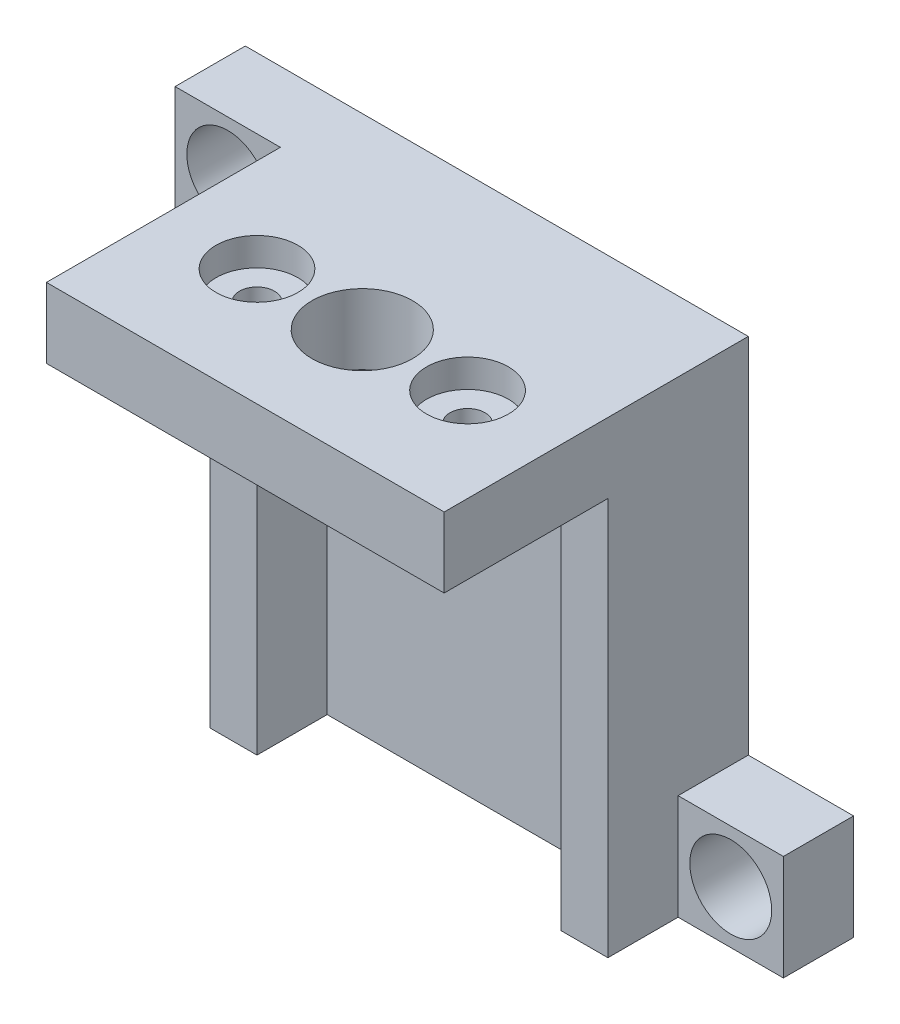
from build123d import *

# Parameters (mm, degrees)
BOSS_EXTRUDE1_DEPTH = 3
BOSS_EXTRUDE2_DEPTH = 3
SKETCH3_W           = 17
SKETCH3_H           = 13
SKETCH3_R           = 2.15
SKETCH3_R_2         = 0.75
BOSS_EXTRUDE3_DEPTH = 3
CUT_EXTRUDE2_REACH  = 32.336
SKETCH6_R           = 2.15
CUT_EXTRUDE3_REACH  = 33.02
SKETCH8_R           = 1.75
SKETCH4_R           = 1.75
CUT_EXTRUDE4_DEPTH  = 1.2


with BuildPart() as part:
    # Sketch1 → Boss-Extrude1 (new body)
    with BuildSketch(Plane.XY):
        Polygon((0, 0), (17, 0), (21.5, 0), (21.5, 4.5), (17, 4.5), (17, 20), (0, 20), (-4.5, 20), (-4.5, 15.5), (0, 15.5), align=None)
    extrude(amount=BOSS_EXTRUDE1_DEPTH)

    # Sketch2 → Boss-Extrude2 (add)
    with BuildSketch(Plane.XY.offset(3)):
        Polygon((0, 20), (0, 15.5), (0, 0), (2, 0), (2, 17), (15, 17), (15, 0), (17, 0), (17, 20), align=None)
    extrude(amount=BOSS_EXTRUDE2_DEPTH)

    # Sketch3 → Boss-Extrude3 (add)
    with BuildSketch(Plane(origin=(0, 20, 0), x_dir=(1, 0, 0), z_dir=(0, 1, 0))):
        with Locations((8.5, -6.5)):
            Rectangle(SKETCH3_W, SKETCH3_H)
        with Locations((8.5, -8)):
            Circle(SKETCH3_R, mode=Mode.SUBTRACT)
        with Locations((13, -8)):
            Circle(SKETCH3_R_2, mode=Mode.SUBTRACT)
        with Locations((4, -8)):
            Circle(SKETCH3_R_2, mode=Mode.SUBTRACT)
    extrude(amount=-BOSS_EXTRUDE3_DEPTH)

    # Sketch6 → Cut-Extrude2 (cut, up to next)
    with BuildSketch(Plane(origin=(0, 17, 0), x_dir=(-1, 0, 0), z_dir=(0, -1, 0)), mode=Mode.PRIVATE) as cut_extrude2_sk1:
        with Locations((-8.5, -8)):
            Circle(SKETCH6_R)
    cut_extrude2_tool1 = extrude(cut_extrude2_sk1.sketch, amount=-CUT_EXTRUDE2_REACH, mode=Mode.PRIVATE) & part.part
    add(cut_extrude2_tool1.solids().sort_by_distance((8.5, 17, 8))[0], mode=Mode.SUBTRACT)

    # Sketch8 → Cut-Extrude3 (cut, up to next)
    with BuildSketch(Plane.XY.offset(3), mode=Mode.PRIVATE) as cut_extrude3_sk1:
        with Locations((19.25, 2.25)):
            Circle(SKETCH8_R)
    cut_extrude3_tool1 = extrude(cut_extrude3_sk1.sketch, amount=-CUT_EXTRUDE3_REACH, mode=Mode.PRIVATE) & part.part
    # Sketch8 → Cut-Extrude3 (cut, up to next)
    with BuildSketch(Plane.XY.offset(3), mode=Mode.PRIVATE) as cut_extrude3_sk2:
        with Locations((-2.25, 17.75)):
            Circle(SKETCH8_R)
    cut_extrude3_tool2 = extrude(cut_extrude3_sk2.sketch, amount=-CUT_EXTRUDE3_REACH, mode=Mode.PRIVATE) & part.part
    add(cut_extrude3_tool1.solids().sort_by_distance((19.25, 2.25, 3))[0], mode=Mode.SUBTRACT)
    add(cut_extrude3_tool2.solids().sort_by_distance((-2.25, 17.75, 3))[0], mode=Mode.SUBTRACT)

    # Sketch4 → Cut-Extrude4 (cut)
    with BuildSketch(Plane(origin=(0, 20, 0), x_dir=(-1, 0, 0), z_dir=(0, -1, 0))):
        with Locations((-4, -8)):
            Circle(SKETCH4_R)
        with Locations((-13, -8)):
            Circle(SKETCH4_R)
    extrude(amount=CUT_EXTRUDE4_DEPTH, mode=Mode.SUBTRACT)


solid = part.part
